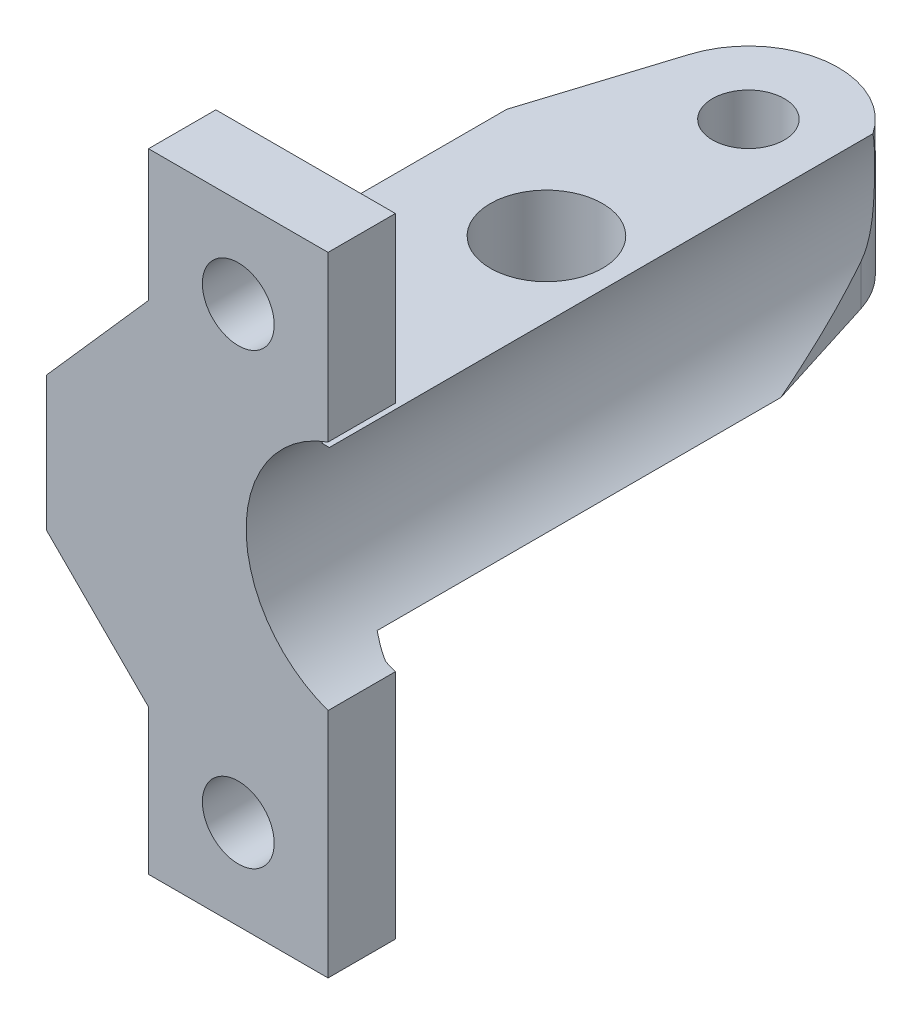
from build123d import *

# Parameters (mm, degrees)
SKETCH_1_W               = 8
SKETCH_1_H               = 28
EXTRUDE_1_DEPTH          = 3
EXTRUDE_2_DEPTH          = 3
EXTRUDE_2_DEPTH_BACK     = 3
SKETCH_2_R               = 1.6
SKETCH_2_R_2             = 2.5
CUT_EXTRUDE_1_DEPTH      = 43.561738686
CUT_EXTRUDE_1_DEPTH_BACK = 43.561738686
SKETCH_3_R               = 5.5
EXTRUDE_3_DEPTH          = 3
SKETCH_6_R               = 1.6
CUT_EXTRUDE_2_DEPTH      = 41.5401234
CHAMFER_1_SIZE           = 0.5


with BuildPart() as part:
    # Эскиз1 → Бобышка-Вытянуть1 (new body)
    with BuildSketch(Plane.XY):
        with Locations((-4, -14)):
            Rectangle(SKETCH_1_W, SKETCH_1_H)
    extrude(amount=EXTRUDE_1_DEPTH)

    # Эскиз2 → Бобышка-Вытянуть2 (add, two sides: drawn at the far end of the back side and taken through both)
    with BuildSketch(Plane(origin=(0, -14, 0), x_dir=(1, 0, 0), z_dir=(0, 1, 0)).offset(-EXTRUDE_2_DEPTH_BACK)):
        with BuildLine():
            Line((-1, 9.5), (-1, 17.5))
            Line((-1, 17.5), (-2.955024535, 23.702481686))
            ThreePointArc((-2.955024535, 23.702481686), (-6.77, 26.5), (-10.584975465, 23.702481686))
            Line((-10.584975465, 23.702481686), (-12.54, 17.5))
            Line((-12.54, 17.5), (-12.54, 9.5))
            Line((-12.54, 9.5), (-12.54, -3))
            Line((-12.54, -3), (0, -3))
            Line((0, -3), (0, 0))
            Line((0, 0), (-1, 0))
            Line((-1, 0), (-1, 9.5))
        make_face()
        with Locations(Location((-6.77, 22.5, 0), (0, 0, 180))):
            Circle(SKETCH_2_R, mode=Mode.SUBTRACT)
        with Locations(Location((-6.77, 4.5, 0), (0, 0, 180))):
            Circle(SKETCH_2_R, mode=Mode.SUBTRACT)
        with Locations(Location((-6.77, 13.5, 0), (0, 0, 180))):
            Circle(SKETCH_2_R_2, mode=Mode.SUBTRACT)
    extrude(amount=EXTRUDE_2_DEPTH + EXTRUDE_2_DEPTH_BACK)

    # Эскиз3 → Вырез-Вытянуть1 (cut, two sides: drawn at the far end of the back side and taken through both)
    with BuildSketch(Plane.XY.offset(3).offset(-CUT_EXTRUDE_1_DEPTH_BACK)):
        with Locations((1.85, -12.5)):
            Circle(SKETCH_3_R)
    extrude(amount=CUT_EXTRUDE_1_DEPTH + CUT_EXTRUDE_1_DEPTH_BACK, mode=Mode.SUBTRACT)

    # Эскиз4 → Бобышка-Вытянуть3 (add)
    with BuildSketch(Plane.XY.offset(3)):
        Polygon((-12.54, -11), (-8, -5.855638374), (-8, -21.54), (-12.54, -17), align=None)
    extrude(amount=-EXTRUDE_3_DEPTH)

    # Эскиз6 → Вырез-Вытянуть2 (cut, through all)
    with BuildSketch(Plane(origin=(0, 0, 0), x_dir=(-1, 0, 0), z_dir=(0, 0, -1))):
        with Locations((4, -4)):
            Circle(SKETCH_6_R)
        with Locations((4, -24)):
            Circle(SKETCH_6_R)
    extrude(amount=-CUT_EXTRUDE_2_DEPTH, mode=Mode.SUBTRACT)

    # Фаска1
    chamfer_1_edges = [part.edges().sort_by_distance(p)[0] for p in [
        (-6.92613883, -17, 0),
        (-7.990751311, -11, 0),
    ]]
    chamfer(chamfer_1_edges, length=CHAMFER_1_SIZE)


solid = part.part
